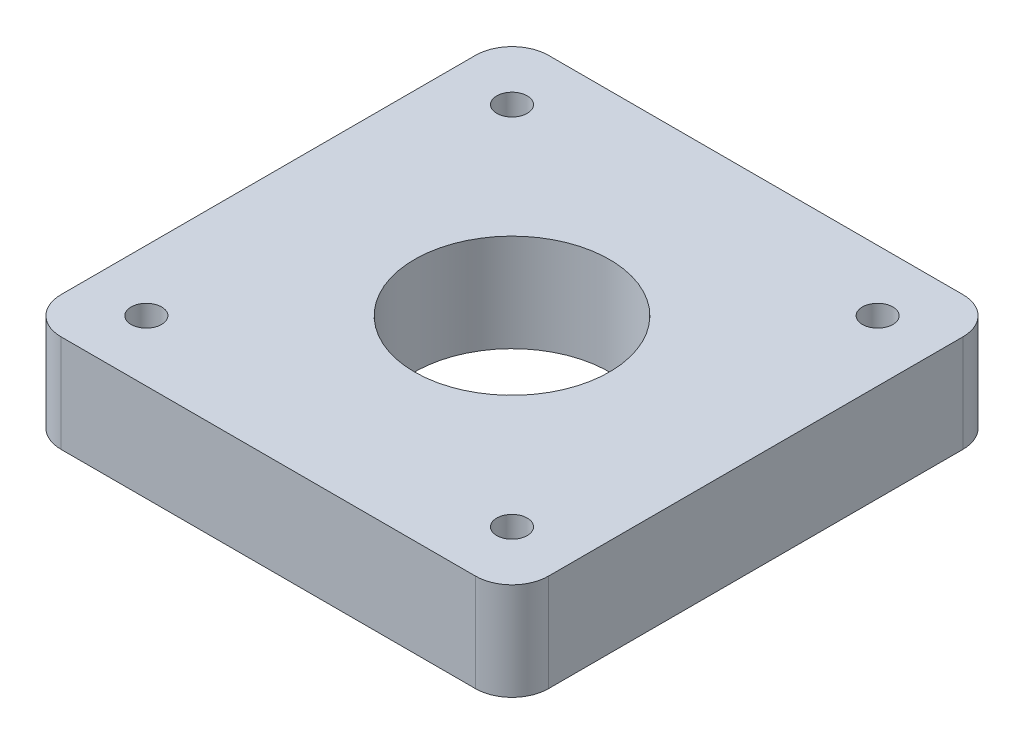
from build123d import *

# Parameters (mm, degrees)
SKETCH1_W           = 40
SKETCH1_H           = 40
SKETCH1_R           = 8
BOSS_EXTRUDE1_DEPTH = 8
SKETCH12_R          = 1.25
CUT_EXTRUDE1_DEPTH  = 58.053472861
FILLET1_R           = 3


with BuildPart() as part:
    # Sketch1 → Boss-Extrude1 (new body)
    with BuildSketch(Plane(origin=(0, 0, 0), x_dir=(1, 0, 0), z_dir=(0, 1, 0))):
        with Locations((20, -19.888579387)):
            Rectangle(SKETCH1_W, SKETCH1_H)
        with Locations(Location((20, -19.888579387, 0), (0, 0, 270))):
            Circle(SKETCH1_R, mode=Mode.SUBTRACT)
    extrude(amount=BOSS_EXTRUDE1_DEPTH)

    # Sketch12 → Cut-Extrude1 (cut, through all)
    with BuildSketch(Plane(origin=(0, 8, 0), x_dir=(1, 0, 0), z_dir=(0, 1, 0))):
        with Locations(Location((5, -4.888579387, 0), (0, 0, 270))):
            Circle(SKETCH12_R)
        with Locations(Location((35, -4.888579387, 0), (0, 0, 270))):
            Circle(SKETCH12_R)
        with Locations(Location((35, -34.888579387, 0), (0, 0, 270))):
            Circle(SKETCH12_R)
        with Locations(Location((5, -34.888579387, 0), (0, 0, 270))):
            Circle(SKETCH12_R)
    extrude(amount=-CUT_EXTRUDE1_DEPTH, mode=Mode.SUBTRACT)

    # Fillet1
    fillet1_edges = [part.edges().sort_by_distance(p)[0] for p in [
        (0, 4, -0.111420613),
        (40, 4, -0.111420613),
        (40, 4, 39.888579387),
        (0, 4, 39.888579387),
    ]]
    fillet(fillet1_edges, radius=FILLET1_R)


solid = part.part
